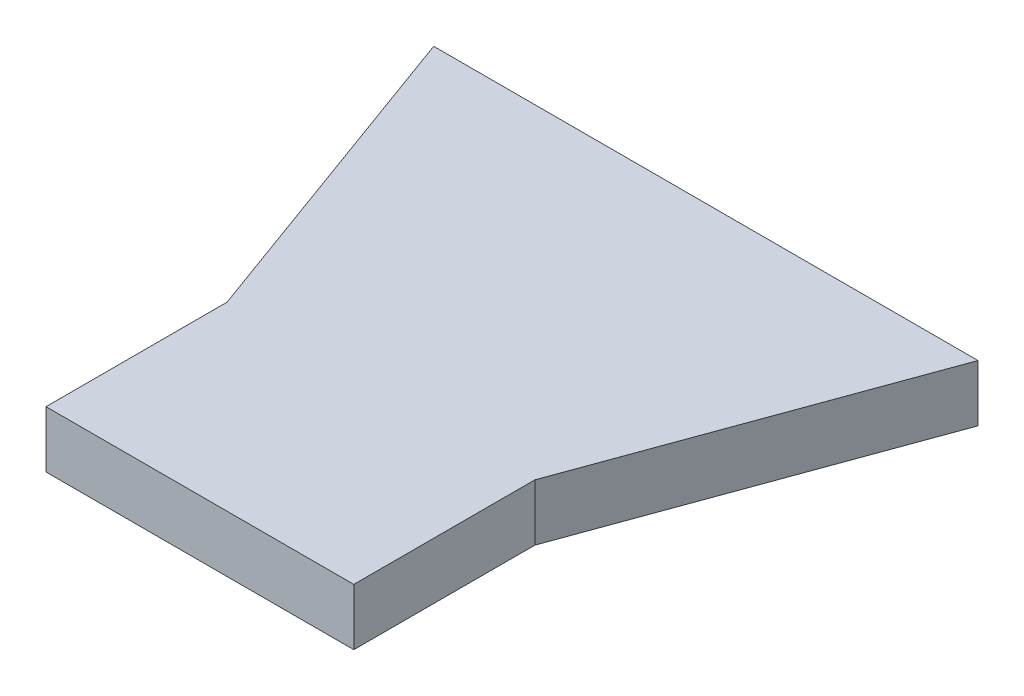
from build123d import *

# Parameters (mm, degrees)
BOSS_EXTRUDE1_DEPTH = 25


with BuildPart() as part:
    # Sketch2 → Boss-Extrude1 (new body)
    with BuildSketch(Plane(origin=(0, 0, 0), x_dir=(1, 0, 0), z_dir=(0, 1, 0))):
        Polygon((0, 0), (136, 0), (136, 80), (188.253518923, 223.565363327), (-52.253518923, 223.565363327), (0, 80), align=None)
    extrude(amount=BOSS_EXTRUDE1_DEPTH)


solid = part.part
